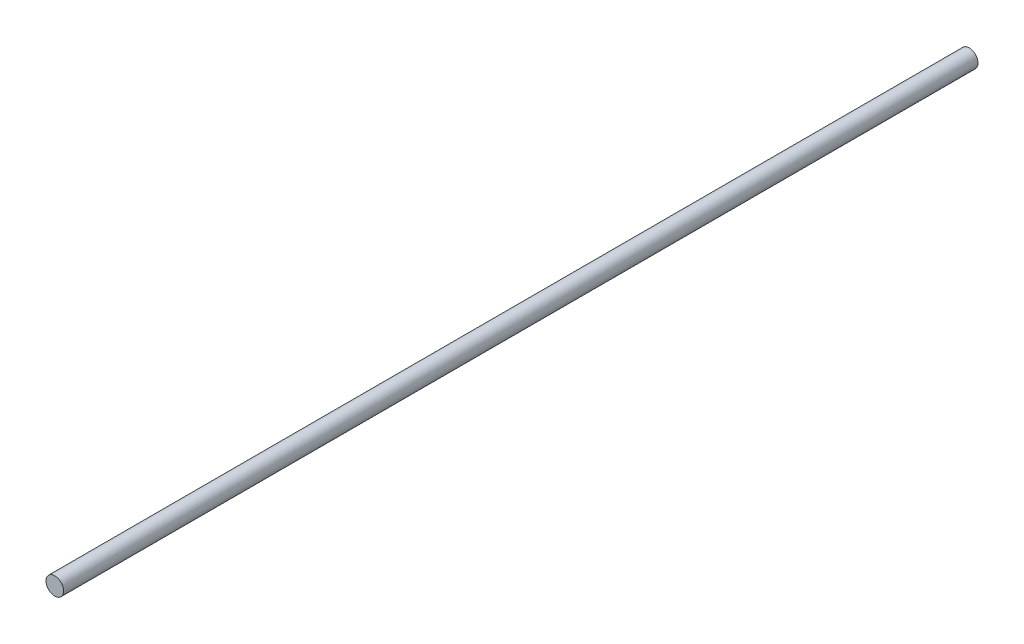
from build123d import *

# Parameters (mm, degrees)
SKETCH1_R           = 4
BOSS_EXTRUDE1_DEPTH = 415


with BuildPart() as part:
    # Sketch1 → Boss-Extrude1 (new body)
    with BuildSketch(Plane.XY):
        Circle(SKETCH1_R)
    extrude(amount=BOSS_EXTRUDE1_DEPTH)


solid = part.part
